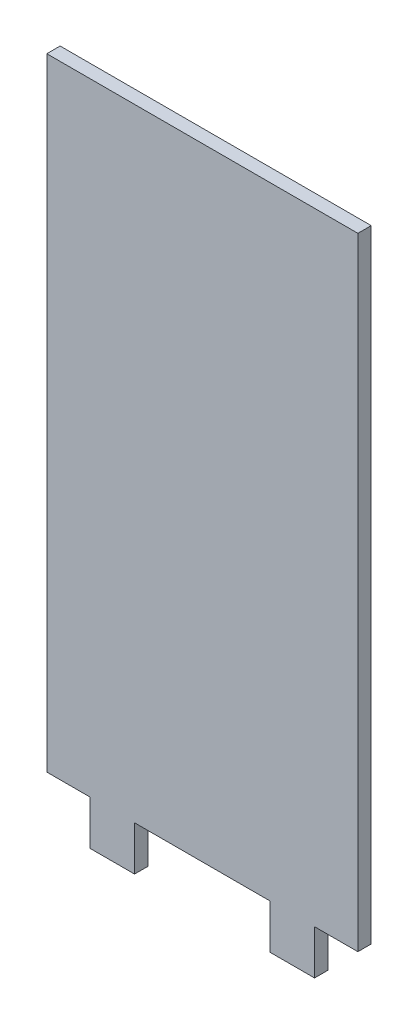
from build123d import *

# Parameters (mm, degrees)
SKIZZE1_W                        = 35
SKIZZE1_H                        = 75
AUFSATZ_LINEAR_AUSTRAGEN1_DEPTH  = 1.5
SKIZZE3_W                        = 15.25
SKIZZE3_H                        = 5
SKIZZE3_W_2                      = 4.875
SCHNITT_LINEAR_AUSTRAGEN12_DEPTH = 20


with BuildPart() as part:
    # Skizze1 → Aufsatz-Linear austragen1 (new body)
    with BuildSketch(Plane.XY):
        with Locations((17.5, 37.5)):
            Rectangle(SKIZZE1_W, SKIZZE1_H)
    extrude(amount=AUFSATZ_LINEAR_AUSTRAGEN1_DEPTH)

    # Skizze3 → Schnitt-Linear austragen12 (cut)
    with BuildSketch(Plane.XY.offset(1.5)):
        with Locations((17.5, 2.5)):
            Rectangle(SKIZZE3_W, SKIZZE3_H)
        with Locations((32.5625, 2.5)):
            Rectangle(SKIZZE3_W_2, SKIZZE3_H)
        with Locations((2.4375, 2.5)):
            Rectangle(SKIZZE3_W_2, SKIZZE3_H)
    extrude(amount=-SCHNITT_LINEAR_AUSTRAGEN12_DEPTH, mode=Mode.SUBTRACT)


solid = part.part
